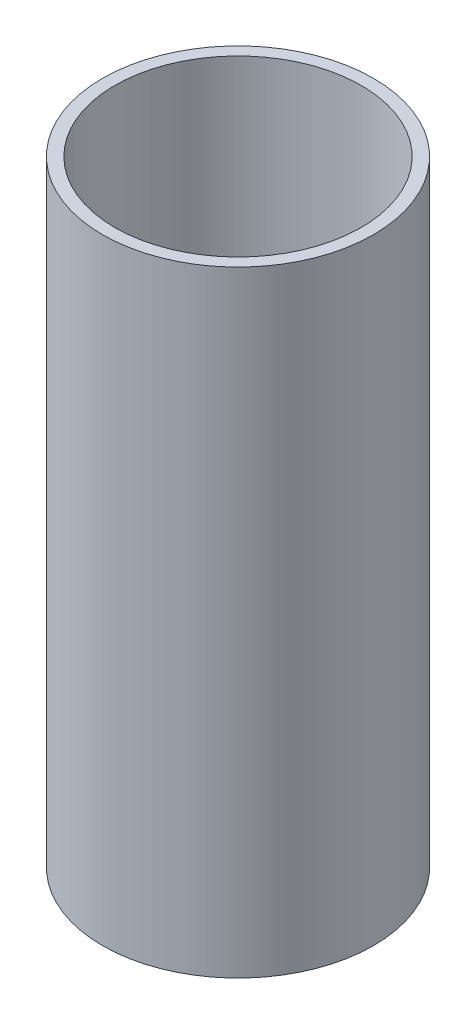
from build123d import *

# Parameters (mm, degrees)
SKETCH1_R           = 11
SKETCH1_R_2         = 10
BOSS_EXTRUDE1_DEPTH = 50


with BuildPart() as part:
    # Sketch1 → Boss-Extrude1 (new body)
    with BuildSketch(Plane(origin=(0, 0, 0), x_dir=(1, 0, 0), z_dir=(0, 1, 0))):
        with Locations(Location((0, 0, 0), (0, 0, 270))):
            Circle(SKETCH1_R)
        with Locations(Location((0, 0, 0), (0, 0, 270))):
            Circle(SKETCH1_R_2, mode=Mode.SUBTRACT)
    extrude(amount=BOSS_EXTRUDE1_DEPTH)


solid = part.part
